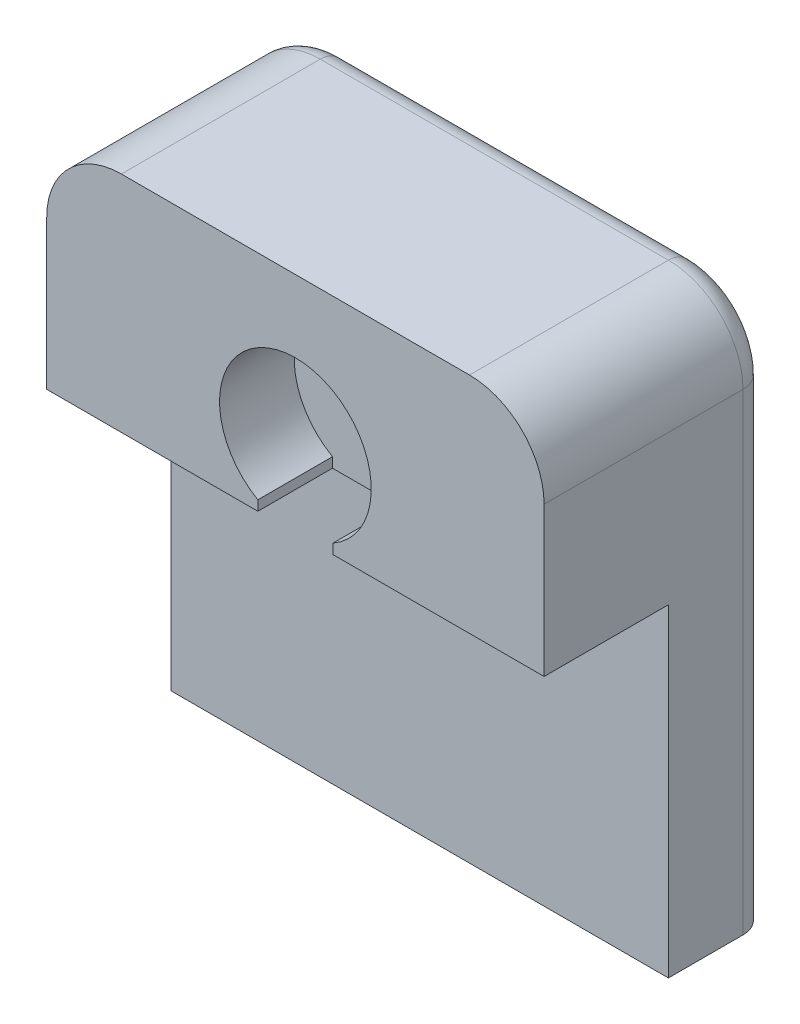
from build123d import *

# Parameters (mm, degrees)
SKETCH1_W           = 20
SKETCH1_H           = 9
BOSS_EXTRUDE1_DEPTH = 13
CUT_EXTRUDE1_DEPTH  = 3
FILLET1_R           = 3
SKETCH3_W           = 20
SKETCH3_H           = 4
CUT_EXTRUDE2_DEPTH  = 61
SKETCH3_3_W         = 20
SKETCH3_3_H         = 4
BOSS_EXTRUDE2_DEPTH = 13
FILLET4_R           = 1


with BuildPart() as part:
    # Sketch1 → Boss-Extrude1 (new body)
    with BuildSketch(Plane.XY):
        Rectangle(SKETCH1_W, SKETCH1_H)
    extrude(amount=BOSS_EXTRUDE1_DEPTH)

    # Sketch2 → Cut-Extrude1 (cut)
    with BuildSketch(Plane.XY.offset(13)):
        with BuildLine():
            Line((1.51, -4.5), (1.51, -4.099981132))
            ThreePointArc((1.51, -4.099981132), (0, 1.6), (-1.51, -4.099981132))
            Line((-1.51, -4.099981132), (-1.51, -4.5))
            Line((-1.51, -4.5), (1.51, -4.5))
        make_face()
    extrude(amount=-CUT_EXTRUDE1_DEPTH, mode=Mode.SUBTRACT)

    # Fillet1
    fillet1_edges = [part.edges().sort_by_distance(p)[0] for p in [
        (-10, 4.5, 6.5),
        (10, 4.5, 6.5),
    ]]
    fillet(fillet1_edges, radius=FILLET1_R)

    # Sketch3 → Cut-Extrude2 (cut)
    with BuildSketch(Plane.XZ.offset(4.5)):
        with Locations((0, 2)):
            Rectangle(SKETCH3_W, SKETCH3_H)
    extrude(amount=-CUT_EXTRUDE2_DEPTH, mode=Mode.SUBTRACT)

    # Sketch3<3> → Boss-Extrude2 (add)
    with BuildSketch(Plane.XZ.offset(4.5)):
        with Locations((0, 6)):
            Rectangle(SKETCH3_3_W, SKETCH3_3_H)
    extrude(amount=BOSS_EXTRUDE2_DEPTH)

    # Fillet4
    fillet4_edges = [part.edges().sort_by_distance(p)[0] for p in [
        (10, -8, 4),
        (9.121320344, 3.621320344, 4),
        (0, 4.5, 4),
        (-9.121320344, 3.621320344, 4),
        (-10, -8, 4),
    ]]
    fillet(fillet4_edges, radius=FILLET4_R)


solid = part.part
